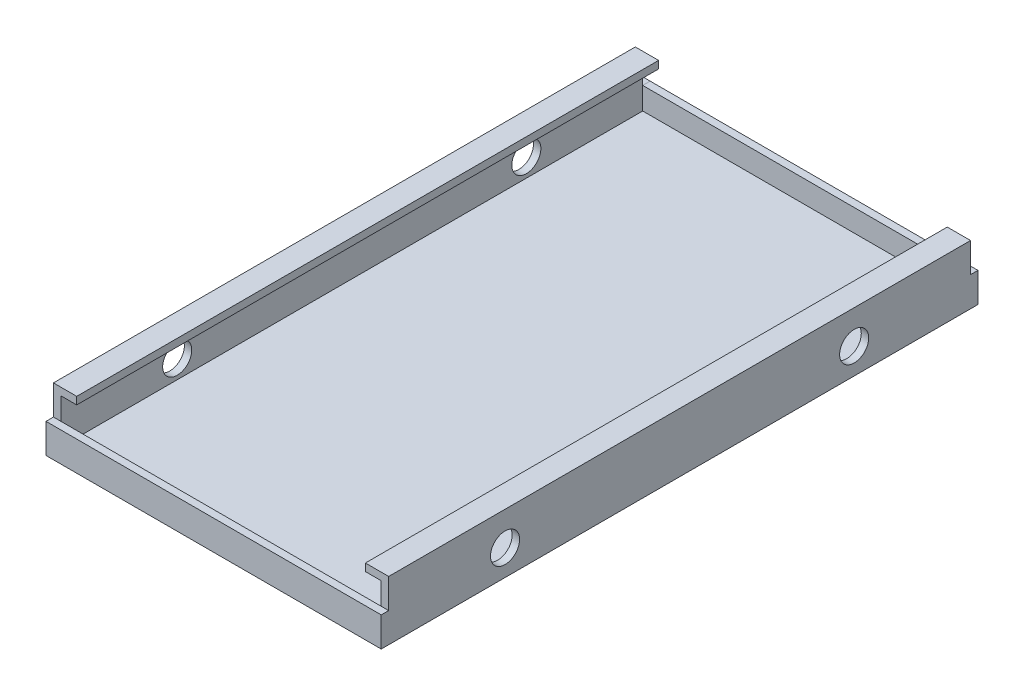
from build123d import *

# Parameters (mm, degrees)
BOSS_EXTRUDE1_DEPTH = 500
SKETCH2_R           = 12.5
CUT_EXTRUDE1_DEPTH  = 485.648
SKETCH3_W           = 500
SKETCH3_H           = 6.4
BOSS_EXTRUDE3_DEPTH = 20
SKETCH4_W           = 500
SKETCH4_H           = 6.4
BOSS_EXTRUDE4_DEPTH = 20
BOSS_EXTRUDE5_DEPTH = 6.4
SKETCH6_W           = 288.065528703
SKETCH6_H           = 25.425
BOSS_EXTRUDE6_DEPTH = 6.4


with BuildPart() as part:
    # Sketch1 → Boss-Extrude1 (new body)
    with BuildSketch(Plane.XY):
        Polygon((-69.85, 19.05), (-69.85, -19.049737181), (69.85, -19.049737181), (205.465528703, -19.049737181), (205.465528703, 19.05), (211.865528703, 19.05), (211.865528703, -25.4), (76.2, -25.4), (-76.2, -25.4), (-76.2, 19.05), align=None)
    extrude(amount=BOSS_EXTRUDE1_DEPTH)

    # Sketch2 → Cut-Extrude1 (cut)
    with BuildSketch(Plane(origin=(211.865528703, 0, 0), x_dir=(0, 0, -1), z_dir=(1, 0, 0))):
        with Locations(Location((-400, -3.2, 0), (0, 0, 180))):
            Circle(SKETCH2_R)
        with Locations(Location((-100, -3.2, 0), (0, 0, 180))):
            Circle(SKETCH2_R)
    extrude(amount=-CUT_EXTRUDE1_DEPTH, mode=Mode.SUBTRACT)

    # Sketch3 → Boss-Extrude3 (add)
    with BuildSketch(Plane(origin=(211.865528703, 0, 0), x_dir=(0, 0, -1), z_dir=(1, 0, 0))):
        with Locations((-250, 22.25)):
            Rectangle(SKETCH3_W, SKETCH3_H)
    extrude(amount=-BOSS_EXTRUDE3_DEPTH)

    # Sketch4 → Boss-Extrude4 (add)
    with BuildSketch(Plane.ZY.offset(76.2)):
        with Locations((250, 22.25)):
            Rectangle(SKETCH4_W, SKETCH4_H)
    extrude(amount=-BOSS_EXTRUDE4_DEPTH)

    # Sketch5 → Boss-Extrude5 (add)
    with BuildSketch(Plane(origin=(0, 0, 0), x_dir=(-1, 0, 0), z_dir=(0, 0, -1))):
        Polygon((-211.865528703, -25.4), (76.2, -25.4), (76.2, -19.058688743), (76.2, 0.025), (69.85, 0.00013141), (-205.465528703, 0.00013141), (-211.865528703, 0.025), (-211.865528703, -19.058688743), align=None)
    extrude(amount=BOSS_EXTRUDE5_DEPTH)

    # Sketch6 → Boss-Extrude6 (add)
    with BuildSketch(Plane.XY.offset(500)):
        with Locations((67.832764352, -12.6875)):
            Rectangle(SKETCH6_W, SKETCH6_H)
    extrude(amount=BOSS_EXTRUDE6_DEPTH)


solid = part.part
